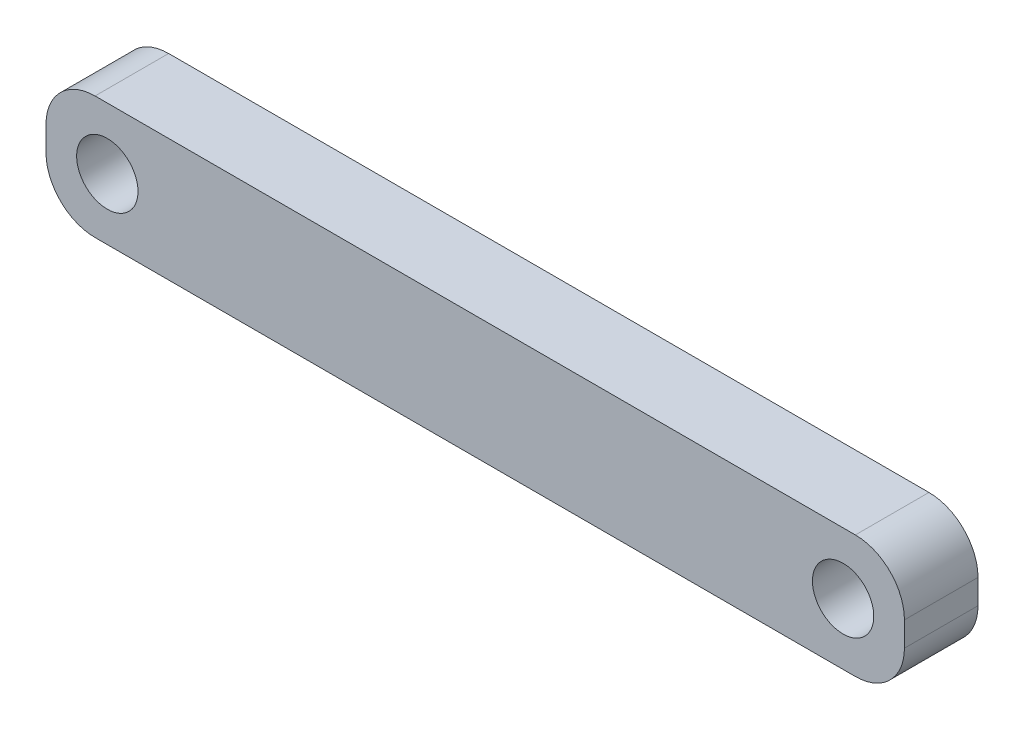
from build123d import *

# Parameters (mm, degrees)
SKETCH1_R           = 2.5
BOSS_EXTRUDE1_DEPTH = 6


with BuildPart() as part:
    # Sketch1 → Boss-Extrude1 (new body)
    with BuildSketch(Plane.XY):
        with BuildLine():
            Line((-31, 5), (31, 5))
            ThreePointArc((31, 5), (33.828427125, 3.828427125), (35, 1))
            Line((35, 1), (35, -1))
            ThreePointArc((35, -1), (33.828427125, -3.828427125), (31, -5))
            Line((31, -5), (-31, -5))
            ThreePointArc((-31, -5), (-33.828427125, -3.828427125), (-35, -1))
            Line((-35, -1), (-35, 1))
            ThreePointArc((-35, 1), (-33.828427125, 3.828427125), (-31, 5))
        make_face()
        with Locations((-30, 0)):
            Circle(SKETCH1_R, mode=Mode.SUBTRACT)
        with Locations(Location((30, 0, 0), (0, 0, 180))):
            Circle(SKETCH1_R, mode=Mode.SUBTRACT)
    extrude(amount=BOSS_EXTRUDE1_DEPTH)


solid = part.part
